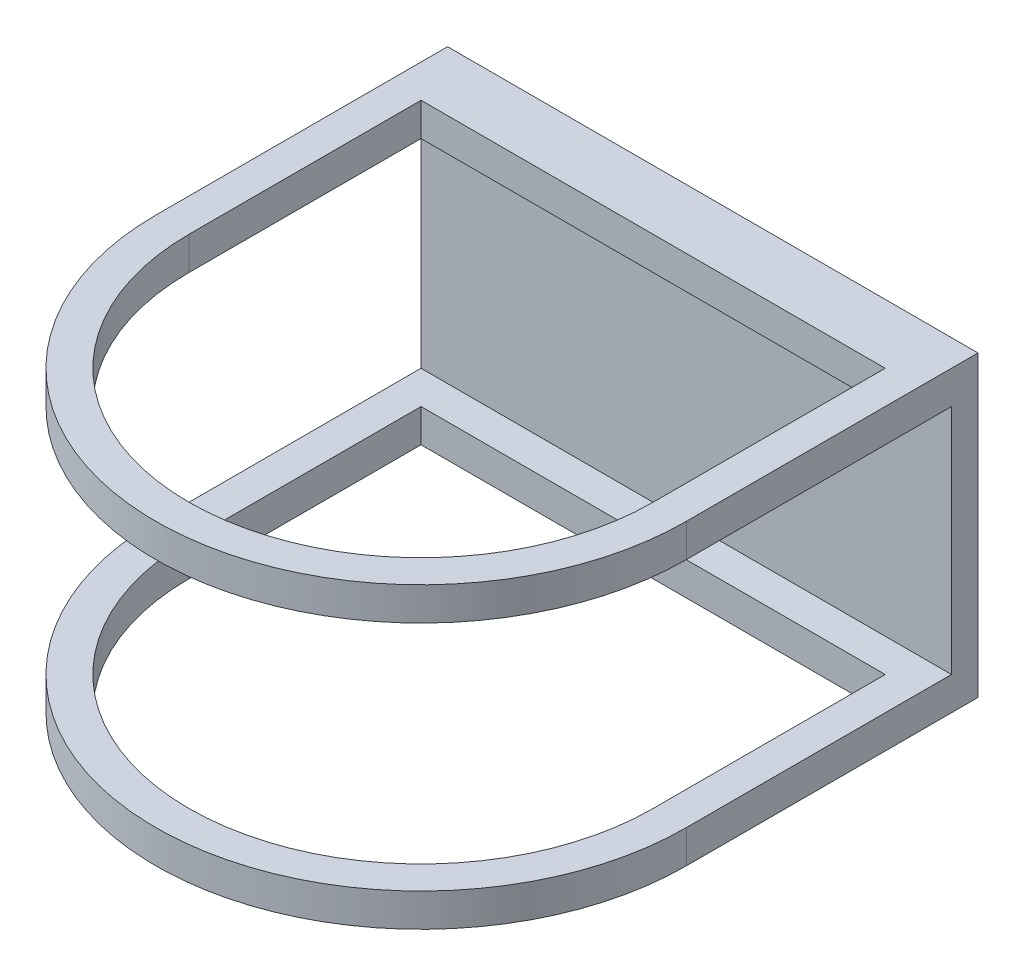
from build123d import *
from build123d.topology import SkipClean

# Parameters (mm, degrees)
EXTRUSION1_DEPTH           = 6.35
HOLE1_D                    = 4.826
HOLE1_DEPTH                = 25.4
RECTANGULAR_PATTERN1_COUNT = 2
RECTANGULAR_PATTERN1_PITCH = 50.8
SKETCH6_W                  = 101.6
SKETCH6_H                  = 57.15
SKETCH6_R                  = 2.413
EXTRUSION3_DEPTH           = 5.08


with BuildPart() as part:
    # Sketch1 → Extrusion1 (new body)
    with BuildSketch(Plane(origin=(0, 0, 0), x_dir=(-1, 0, 0), z_dir=(0, 1, 0))):
        with BuildLine():
            Line((-50.8, -50.8), (50.8, -50.8))
            Line((50.8, -50.8), (50.8, 0))
            ThreePointArc((50.8, 0), (0, 50.8), (-50.8, 0))
            Line((-50.8, 0), (-50.8, -50.8))
        make_face()
        with BuildLine():
            Line((44.45, 0), (44.45, -44.45))
            Line((44.45, -44.45), (-44.45, -44.45))
            Line((-44.45, -44.45), (-44.45, 0))
            ThreePointArc((-44.45, 0), (0, 44.45), (44.45, 0))
        make_face(mode=Mode.SUBTRACT)
    extrude(amount=EXTRUSION1_DEPTH)

    # Hole1
    with Locations(Plane(origin=(0, 0, -50.8), x_dir=(-1, 0, 0), z_dir=(0, 0, -1))):
        with Locations((-47.625, 3.175), (47.625, 3.175)):
            Hole(HOLE1_D / 2, depth=HOLE1_DEPTH)


with BuildPart() as rectangular_pattern1_1:
    # Rectangular Pattern1: pattern copy
    add(part.part.moved(Location(Vector(0, 1, 0) * (1 * RECTANGULAR_PATTERN1_PITCH))))


with BuildPart() as part_1:
    with SkipClean():  # the faces are left unmerged after this step: merging them gives an invalid solid
        add(part.part)

        add(rectangular_pattern1_1.part)  # Extrusion3 merges Rectangular Pattern1_1
        # Sketch6 → Extrusion3 (add)
        with BuildSketch(Plane(origin=(0, 0, -50.8), x_dir=(-1, 0, 0), z_dir=(0, 0, -1))):
            with Locations((0, 28.575)):
                Rectangle(SKETCH6_W, SKETCH6_H)
            with Locations((-47.625, 53.975)):
                Circle(SKETCH6_R, mode=Mode.SUBTRACT)
            with Locations((47.625, 53.975)):
                Circle(SKETCH6_R, mode=Mode.SUBTRACT)
        extrude(amount=EXTRUSION3_DEPTH)


solid = part_1.part
